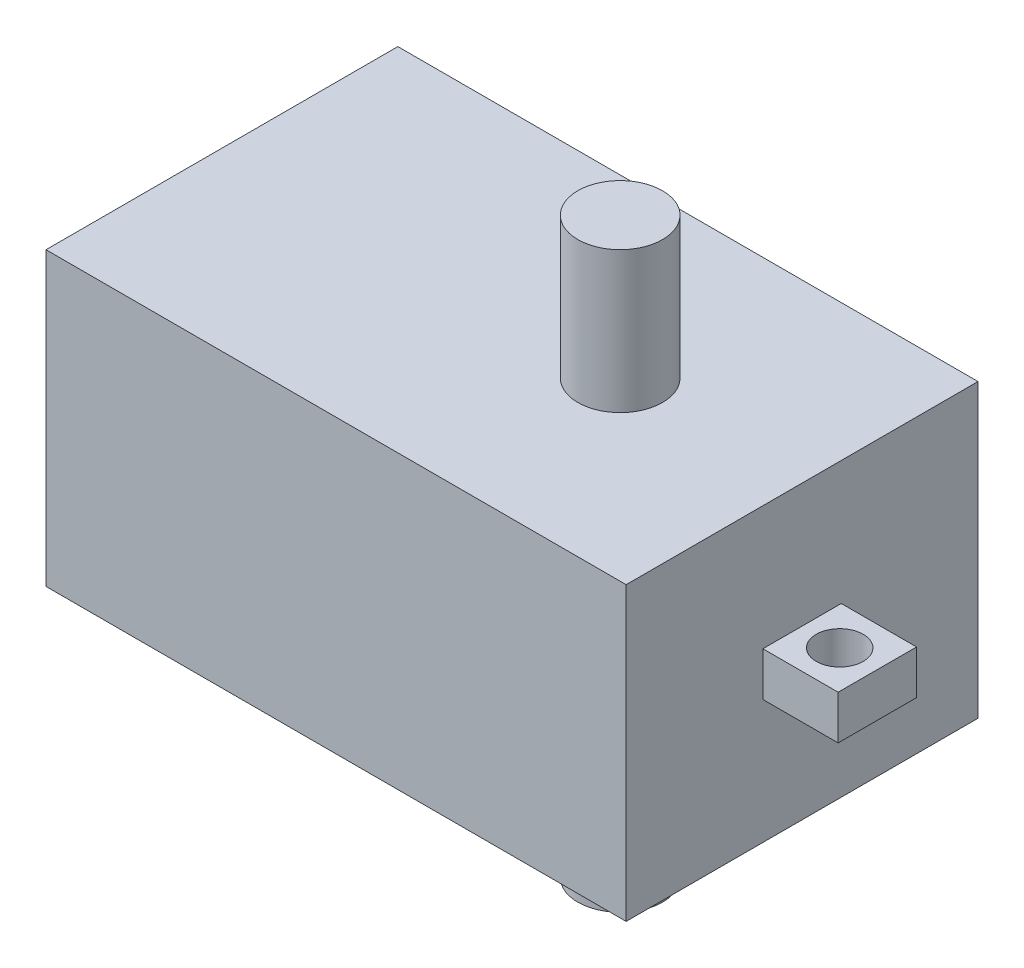
from build123d import *

# Parameters (mm, degrees)
SKETCH1_W           = 37
SKETCH1_H           = 18.6
BOSS_EXTRUDE1_DEPTH = 22.44
SKETCH6_W           = 5
SKETCH6_H           = 2.8
BOSS_EXTRUDE2_DEPTH = 4.8
CUT_EXTRUDE1_REACH  = 36.072
SKETCH7_R           = 1.5
SKETCH8_R           = 2.7
BOSS_EXTRUDE3_DEPTH = 9


with BuildPart() as part:
    # Sketch1 → Boss-Extrude1 (new body)
    with BuildSketch(Plane.XY):
        Rectangle(SKETCH1_W, SKETCH1_H)
    extrude(amount=BOSS_EXTRUDE1_DEPTH)

    # Sketch6 → Boss-Extrude2 (add)
    with BuildSketch(Plane(origin=(18.5, 0, 0), x_dir=(0, 0, -1), z_dir=(1, 0, 0))):
        with Locations((-11.22, 0)):
            Rectangle(SKETCH6_W, SKETCH6_H)
    extrude(amount=BOSS_EXTRUDE2_DEPTH)

    # Sketch7 → Cut-Extrude1 (cut, up to next)
    with BuildSketch(Plane(origin=(0, 1.4, 0), x_dir=(1, 0, 0), z_dir=(0, 1, 0)), mode=Mode.PRIVATE) as cut_extrude1_sk1:
        with Locations(Location((20.9, -11.22, 0), (0, 0, 270))):
            Circle(SKETCH7_R)
    cut_extrude1_tool1 = extrude(cut_extrude1_sk1.sketch, amount=-CUT_EXTRUDE1_REACH, mode=Mode.PRIVATE) & part.part
    add(cut_extrude1_tool1.solids().sort_by_distance((20.9, 1.4, 11.22))[0], mode=Mode.SUBTRACT)

    # Sketch8 → Boss-Extrude3 (add)
    with BuildSketch(Plane(origin=(0, 9.3, 0), x_dir=(1, 0, 0), z_dir=(0, 1, 0))):
        with Locations((6.9, -11.22)):
            Circle(SKETCH8_R)
    boss_extrude3 = extrude(amount=BOSS_EXTRUDE3_DEPTH)

    # Mirror1: Boss-Extrude3 across plane
    add(boss_extrude3.mirror(Plane.ZX))


solid = part.part
